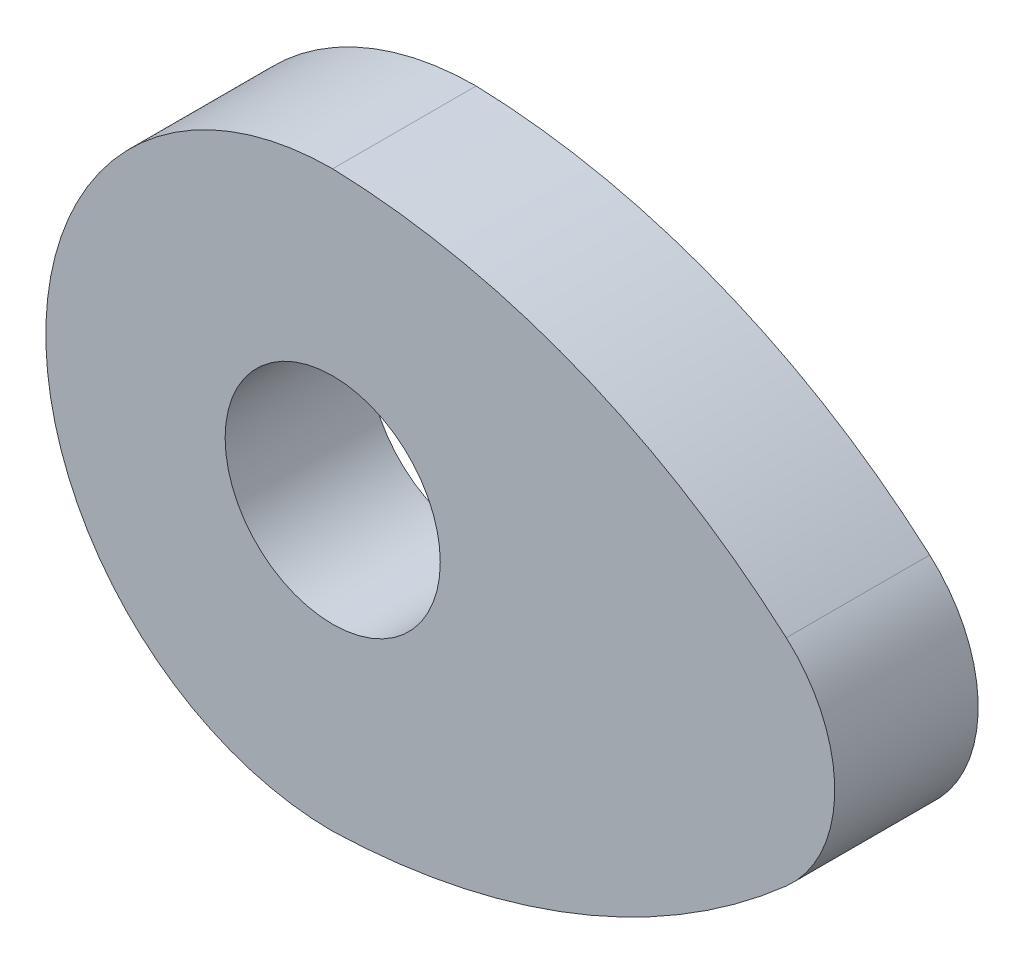
from build123d import *

# Parameters (mm, degrees)
SKETCH1_R           = 7.5
BOSS_EXTRUDE1_DEPTH = 5


with BuildPart() as part:
    # Sketch1 → Boss-Extrude1 (new, symmetric)
    with BuildSketch(Plane.XY):
        with BuildLine():
            ThreePointArc((31.620603921, 7.494504901), (17.82100855, 16.145486471), (1.973178454, 19.902426153))
            ThreePointArc((1.973178454, 19.902426153), (0.987071189, 19.960959504), (0, 20))
            ThreePointArc((0, 20), (-20, 0), (0, -20))
            ThreePointArc((0, -20), (0.987071189, -19.960959504), (1.973178454, -19.902426153))
            ThreePointArc((1.973178454, -19.902426153), (17.82100855, -16.145486471), (31.620603921, -7.494504901))
            ThreePointArc((31.620603921, -7.494504901), (35, 0), (31.620603921, 7.494504901))
        make_face()
        Circle(SKETCH1_R, mode=Mode.SUBTRACT)
    extrude(amount=BOSS_EXTRUDE1_DEPTH, both=True)


solid = part.part
